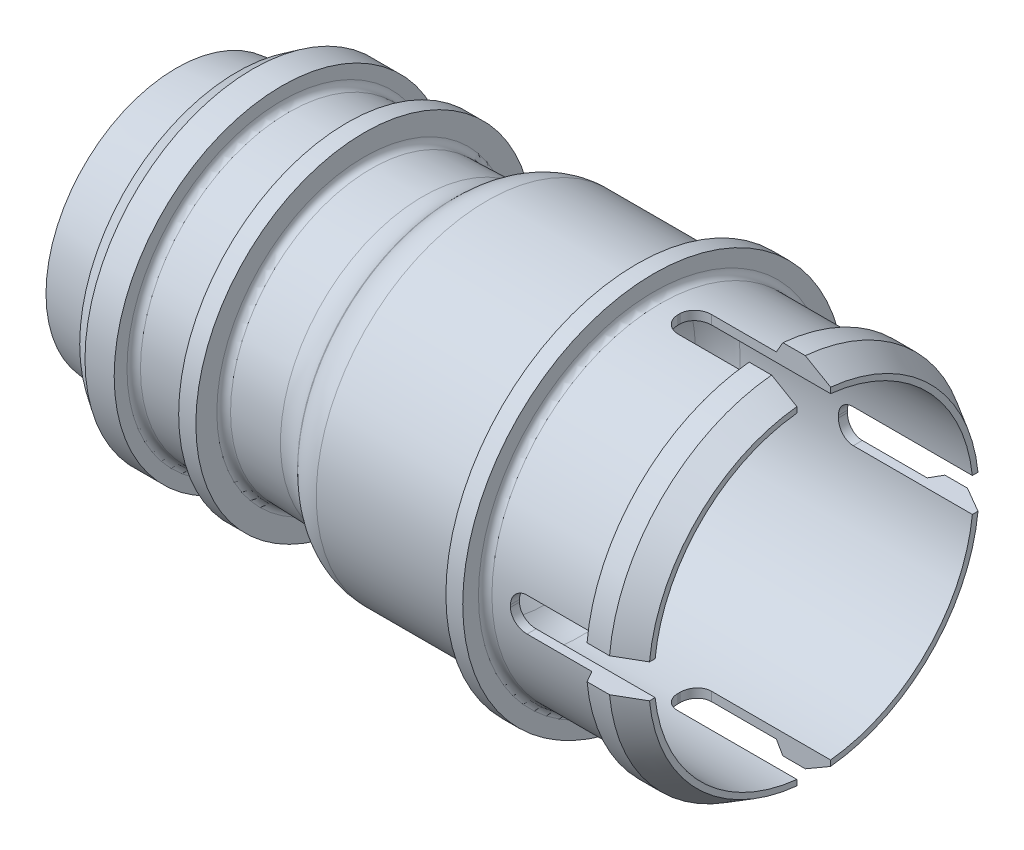
from build123d import *

# Parameters (mm, degrees)
FILLET1_R                = 0.762
SKETCH2_W                = 15.24
SKETCH2_H                = 3.81
CUT_EXTRUDE1_DEPTH       = 50.822214925
FILLET4_R                = 1.778
CIRPATTERN1_COUNT        = 2
CIRPATTERN1_ANGLE        = 90
FILLET4_OF_CIRPATTERN1_R = 1.778
FILLET6_R                = 5.08


with BuildPart() as part:
    # Sketch1 → Revolve1 (revolve)
    with BuildSketch(Plane.XY, mode=Mode.PRIVATE) as revolve1_sk:
        Polygon((-39.37, 13.7795), (0, 13.7795), (4.2545, 18.034), (32.704615883, 18.034), (32.704615883, 18.669), (29.845, 20.32), (27.305, 20.32), (26.571765158, 19.05), (14.605, 19.05), (14.605, 21.59), (12.7, 21.59), (12.7, 19.304), (-6.35, 19.304), (-9.499939799, 16.154060201), (-18.1229, 15.875), (-18.1229, 19.0373), (-20.066, 19.0373), (-20.066, 16.7513), (-27.432, 16.7513), (-27.432, 18.9611), (-30.734, 18.9611), (-32.512, 17.78), (-32.512, 15.621), (-39.37, 14.732), align=None)
    revolve(revolve1_sk.sketch.rotate(Axis((-11.776127049, 0, 0), (1, 0, 0)), 90), axis=Axis((-11.776127049, 0, 0), (1, 0, 0)))

    # Fillet1
    fillet1_edges = [part.edges().sort_by_distance(p)[0] for p in [
        (-27.432, 0, -16.7513),
        (-20.066, 0, -16.7513),
        (-18.1229, 0, -15.875),
        (12.7, 0, -19.304),
        (14.605, 0, -19.05),
    ]]
    fillet(fillet1_edges, radius=FILLET1_R)

    # Sketch2 → Cut-Extrude1 (cut, symmetric)
    with BuildSketch(Plane(origin=(0, 0, 0), x_dir=(1, 0, 0), z_dir=(0, 1, 0))):
        with Locations((25.084615883, 0)):
            Rectangle(SKETCH2_W, SKETCH2_H)
    cut_extrude1 = extrude(amount=CUT_EXTRUDE1_DEPTH, both=True, mode=Mode.SUBTRACT)

    # Fillet4
    fillet4_edges = [part.edges().sort_by_distance(p)[0] for p in [
        (17.464615883, -18.443806111, 1.905),
        (17.464615883, 18.443806111, 1.905),
        (17.464615883, -18.443806111, -1.905),
        (17.464615883, 18.443806111, -1.905),
    ]]
    fillet(fillet4_edges, radius=FILLET4_R)

    # CirPattern1: Cut-Extrude1 ×2 about axis
    cirpattern1_axis = Axis((14.605, 0, 0), (-1, 0, 0))
    for i in range(1, CIRPATTERN1_COUNT):
        add(cut_extrude1.rotate(cirpattern1_axis, i * CIRPATTERN1_ANGLE / (CIRPATTERN1_COUNT - 1)), mode=Mode.SUBTRACT)

    # Fillet4 of CirPattern1
    fillet4_of_cirpattern1_edges = [part.edges().sort_by_distance(p)[0] for p in [
        (17.464615883, 1.905, 18.443806111),
        (17.464615883, 1.905, -18.443806111),
        (17.464615883, -1.905, 18.443806111),
        (17.464615883, -1.905, -18.443806111),
    ]]
    fillet(fillet4_of_cirpattern1_edges, radius=FILLET4_OF_CIRPATTERN1_R)

    # Fillet6
    fillet6_edges = [part.edges().sort_by_distance(p)[0] for p in [
        (-9.499939799, 0, -16.154060201),
        (-6.35, 0, -19.304),
        (4.2545, 0, -18.034),
        (0, 0, -13.7795),
    ]]
    fillet(fillet6_edges, radius=FILLET6_R)


solid = part.part
